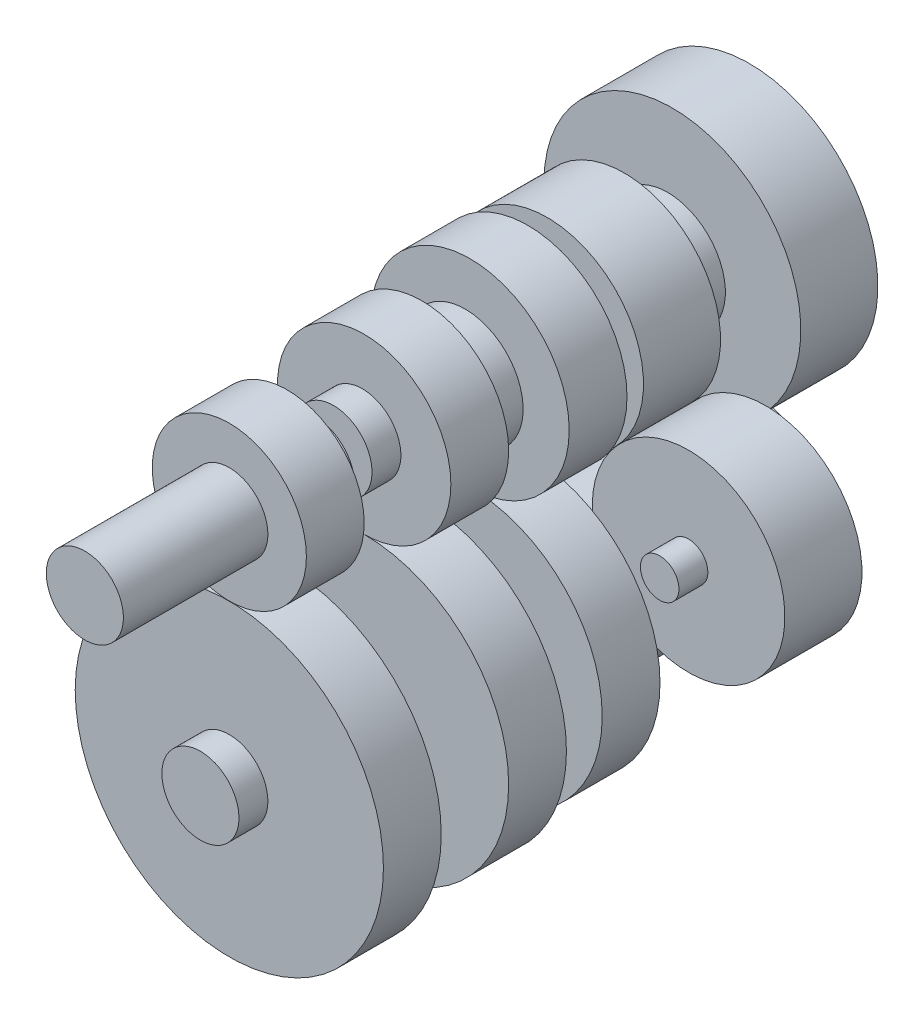
from build123d import *

# Parameters (mm, degrees)
SKETCH1_R             = 101.6
BOSS_EXTRUDE1_DEPTH   = 38.1
SKETCH1_R_2           = 50.8
BOSS_EXTRUDE1_2_DEPTH = 38.1
SKETCH2_R             = 25.4
BOSS_EXTRUDE2_DEPTH   = 50.8
SKETCH3_R             = 95.25
SKETCH3_R_2           = 25.4
SKETCH3_R_3           = 57.15
BOSS_EXTRUDE4_DEPTH   = 38.1
SKETCH4_R             = 25.4
BOSS_EXTRUDE5_DEPTH   = 3.175
SKETCH5_R             = 38.1
BOSS_EXTRUDE6_DEPTH   = 25.4
SKETCH6_R             = 25.4
BOSS_EXTRUDE7_DEPTH   = 3.175
SKETCH7_R             = 25.4
BOSS_EXTRUDE8_DEPTH   = 31.75
SKETCH8_R             = 87.085714286
SKETCH8_R_2           = 25.4
SKETCH8_R_3           = 65.314285714
BOSS_EXTRUDE9_DEPTH   = 38.1
SKETCH9_R             = 25.4
BOSS_EXTRUDE10_DEPTH  = 12.7
SKETCH10_R            = 63.5
SKETCH10_R_2          = 50.8
SKETCH10_R_3          = 25.4
BOSS_EXTRUDE11_DEPTH  = 50.8
SKETCH11_R            = 25.4
BOSS_EXTRUDE12_DEPTH  = 31.75
SKETCH12_R            = 25.4
BOSS_EXTRUDE13_DEPTH  = 3.175
SKETCH13_R            = 38.1
BOSS_EXTRUDE14_DEPTH  = 25.4
SKETCH14_R            = 25.4
BOSS_EXTRUDE15_DEPTH  = 3.175
SKETCH15_R            = 63.5
SKETCH15_R_2          = 50.8
SKETCH15_R_3          = 25.4
SKETCH15_R_4          = 84.666666667
BOSS_EXTRUDE16_DEPTH  = 50.8
SKETCH16_R            = 12.7
BOSS_EXTRUDE17_DEPTH  = 19.05
SKETCH17_R            = 12.7
BOSS_EXTRUDE18_DEPTH  = 19.05
SKETCH18_R            = 25.4
SKETCH18_R_2          = 12.7
BOSS_EXTRUDE19_DEPTH  = 19.05
SKETCH19_R            = 12.7
BOSS_EXTRUDE20_DEPTH  = 50.8
SKETCH20_R            = 25.4
BOSS_EXTRUDE21_DEPTH  = 19.05
SKETCH21_R            = 25.4
BOSS_EXTRUDE22_DEPTH  = 19.05
SKETCH22_R            = 25.4
BOSS_EXTRUDE23_DEPTH  = 19.05
SKETCH24_R            = 25.4
BOSS_EXTRUDE24_DEPTH  = 76.2


with BuildPart() as part:
    # Sketch1 → Boss-Extrude1 (new body)
    with BuildSketch(Plane.XY):
        Circle(SKETCH1_R)
    extrude(amount=-BOSS_EXTRUDE1_DEPTH)

    # Sketch2 → Boss-Extrude2 (add)
    with BuildSketch(Plane(origin=(0, 0, -38.1), x_dir=(-1, 0, 0), z_dir=(0, 0, -1))):
        Circle(SKETCH2_R)
    extrude(amount=BOSS_EXTRUDE2_DEPTH)

    # Sketch3 → Boss-Extrude4 (add)
    # profile 1 of 3: a face of its own
    with BuildSketch(Plane(origin=(0, 0, -88.9), x_dir=(-1, 0, 0), z_dir=(0, 0, -1))):
        with Locations(Location((0, 0, 0), (0, 0, 180))):
            Circle(SKETCH3_R)
        Circle(SKETCH3_R_2, mode=Mode.SUBTRACT)
    # profile 2 of 3: a face of its own
    with BuildSketch(Plane(origin=(0, 0, -88.9), x_dir=(-1, 0, 0), z_dir=(0, 0, -1))):
        Circle(SKETCH3_R_2)
    # profile 3 of 3: a face of its own
    with BuildSketch(Plane(origin=(0, 0, -88.9), x_dir=(-1, 0, 0), z_dir=(0, 0, -1))):
        with Locations(Location((0, 152.4, 0), (0, 0, 180))):
            Circle(SKETCH3_R_3)
    extrude(amount=BOSS_EXTRUDE4_DEPTH)


with BuildPart() as body_2:
    # Sketch1 → Boss-Extrude1 2 (new body)
    with BuildSketch(Plane.XY):
        with Locations((0, 152.4)):
            Circle(SKETCH1_R_2)
    extrude(amount=-BOSS_EXTRUDE1_2_DEPTH)



with BuildPart() as boss_extrude4_piece_1:
    # of the separate pieces the step leaves, piece 1, a body of its own (boss_extrude4_pieces)
    add(part.part.solids().sort_by_distance((95.25, 0, -88.9))[0])

    # Sketch7 → Boss-Extrude8 (add)
    with BuildSketch(Plane(origin=(0, 0, -127), x_dir=(-1, 0, 0), z_dir=(0, 0, -1))):
        Circle(SKETCH7_R)
    extrude(amount=BOSS_EXTRUDE8_DEPTH)



with BuildPart() as boss_extrude4_piece_2:
    # of the separate pieces the step leaves, piece 2, a body of its own (boss_extrude4_pieces)
    add(part.part.solids().sort_by_distance((57.15, 152.4, -88.9))[0])

    # Sketch4 → Boss-Extrude5 (add)
    with BuildSketch(Plane(origin=(0, 0, -127), x_dir=(-1, 0, 0), z_dir=(0, 0, -1))):
        with Locations((0, 152.4)):
            Circle(SKETCH4_R)
    extrude(amount=BOSS_EXTRUDE5_DEPTH)

    # Sketch5 → Boss-Extrude6 (add)
    with BuildSketch(Plane(origin=(0, 0, -130.175), x_dir=(-1, 0, 0), z_dir=(0, 0, -1))):
        with Locations((0, 152.4)):
            Circle(SKETCH5_R)
    extrude(amount=BOSS_EXTRUDE6_DEPTH)

    # Sketch6 → Boss-Extrude7 (add)
    with BuildSketch(Plane(origin=(0, 0, -155.575), x_dir=(-1, 0, 0), z_dir=(0, 0, -1))):
        with Locations((0, 152.4)):
            Circle(SKETCH6_R)
    extrude(amount=BOSS_EXTRUDE7_DEPTH)


with BuildPart() as boss_extrude4_piece_1_1:
    add(boss_extrude4_piece_1.part)

    add(boss_extrude4_piece_2.part)  # Boss-Extrude9 merges Boss-Extrude4 piece 2
    # Sketch8 → Boss-Extrude9 (add)
    # profile 1 of 3: a face of its own
    with BuildSketch(Plane(origin=(0, 0, -158.75), x_dir=(-1, 0, 0), z_dir=(0, 0, -1))):
        with Locations(Location((0, 0, 0), (0, 0, 180))):
            Circle(SKETCH8_R)
        Circle(SKETCH8_R_2, mode=Mode.SUBTRACT)
    # profile 2 of 3: a face of its own
    with BuildSketch(Plane(origin=(0, 0, -158.75), x_dir=(-1, 0, 0), z_dir=(0, 0, -1))):
        Circle(SKETCH8_R_2)
    # profile 3 of 3: a face of its own
    with BuildSketch(Plane(origin=(0, 0, -158.75), x_dir=(-1, 0, 0), z_dir=(0, 0, -1))):
        with Locations(Location((0, 152.4, 0), (0, 0, 180))):
            Circle(SKETCH8_R_3)
    extrude(amount=BOSS_EXTRUDE9_DEPTH)

    # Sketch9 → Boss-Extrude10 (add)
    with BuildSketch(Plane(origin=(0, 0, -196.85), x_dir=(-1, 0, 0), z_dir=(0, 0, -1))):
        Circle(SKETCH9_R)
        with Locations((0, 152.4)):
            Circle(SKETCH9_R)
    extrude(amount=BOSS_EXTRUDE10_DEPTH)

    # Sketch10 → Boss-Extrude11 (add)
    # profile 1 of 4: a face of its own
    with BuildSketch(Plane(origin=(0, 0, -209.55), x_dir=(-1, 0, 0), z_dir=(0, 0, -1))):
        with Locations((-93.215978956, 66.145833333)):
            Circle(SKETCH10_R)
    # profile 2 of 4: a face of its own
    with BuildSketch(Plane(origin=(0, 0, -209.55), x_dir=(-1, 0, 0), z_dir=(0, 0, -1))):
        Circle(SKETCH10_R_2)
        Circle(SKETCH10_R_3, mode=Mode.SUBTRACT)
    # profile 3 of 4: a face of its own
    with BuildSketch(Plane(origin=(0, 0, -209.55), x_dir=(-1, 0, 0), z_dir=(0, 0, -1))):
        Circle(SKETCH10_R_3)
    # profile 4 of 4: a face of its own
    with BuildSketch(Plane(origin=(0, 0, -209.55), x_dir=(-1, 0, 0), z_dir=(0, 0, -1))):
        with Locations((0, 152.4)):
            Circle(SKETCH10_R)
    extrude(amount=BOSS_EXTRUDE11_DEPTH)

    # Sketch11 → Boss-Extrude12 (add)
    with BuildSketch(Plane(origin=(0, 0, -260.35), x_dir=(-1, 0, 0), z_dir=(0, 0, -1))):
        Circle(SKETCH11_R)
    extrude(amount=BOSS_EXTRUDE12_DEPTH)

    # Sketch12 → Boss-Extrude13 (add)
    with BuildSketch(Plane(origin=(0, 0, -260.35), x_dir=(-1, 0, 0), z_dir=(0, 0, -1))):
        with Locations((0, 152.4)):
            Circle(SKETCH12_R)
    extrude(amount=BOSS_EXTRUDE13_DEPTH)

    # Sketch13 → Boss-Extrude14 (add)
    with BuildSketch(Plane(origin=(0, 0, -263.525), x_dir=(-1, 0, 0), z_dir=(0, 0, -1))):
        with Locations((0, 152.4)):
            Circle(SKETCH13_R)
    extrude(amount=BOSS_EXTRUDE14_DEPTH)

    # Sketch14 → Boss-Extrude15 (add)
    with BuildSketch(Plane(origin=(0, 0, -288.925), x_dir=(-1, 0, 0), z_dir=(0, 0, -1))):
        with Locations((0, 152.4)):
            Circle(SKETCH14_R)
    extrude(amount=BOSS_EXTRUDE15_DEPTH)

    # Sketch15 → Boss-Extrude16 (add)
    # profile 1 of 4: a face of its own
    with BuildSketch(Plane(origin=(0, 0, -292.1), x_dir=(-1, 0, 0), z_dir=(0, 0, -1))):
        with Locations((104.172967447, 47.037037037)):
            Circle(SKETCH15_R)
    # profile 2 of 4: a face of its own
    with BuildSketch(Plane(origin=(0, 0, -292.1), x_dir=(-1, 0, 0), z_dir=(0, 0, -1))):
        Circle(SKETCH15_R_2)
        Circle(SKETCH15_R_3, mode=Mode.SUBTRACT)
    # profile 3 of 4: a face of its own
    with BuildSketch(Plane(origin=(0, 0, -292.1), x_dir=(-1, 0, 0), z_dir=(0, 0, -1))):
        Circle(SKETCH15_R_3)
    # profile 4 of 4: a face of its own
    with BuildSketch(Plane(origin=(0, 0, -292.1), x_dir=(-1, 0, 0), z_dir=(0, 0, -1))):
        with Locations((0, 152.4)):
            Circle(SKETCH15_R_4)
    extrude(amount=BOSS_EXTRUDE16_DEPTH)

    # Sketch16 → Boss-Extrude17 (add)
    with BuildSketch(Plane.XY.offset(-209.55)):
        with Locations(Location((93.215978956, 66.145833333, 0), (0, 0, 180))):
            Circle(SKETCH16_R)
    extrude(amount=BOSS_EXTRUDE17_DEPTH)

    # Sketch17 → Boss-Extrude18 (add)
    with BuildSketch(Plane(origin=(0, 0, -260.35), x_dir=(-1, 0, 0), z_dir=(0, 0, -1))):
        with Locations((-93.215978956, 66.145833333)):
            Circle(SKETCH17_R)
    extrude(amount=BOSS_EXTRUDE18_DEPTH)

    # Sketch18 → Boss-Extrude19 (add)
    with BuildSketch(Plane(origin=(0, 0, -342.9), x_dir=(-1, 0, 0), z_dir=(0, 0, -1))):
        with Locations((0, 152.4)):
            Circle(SKETCH18_R)
        with Locations(Location((104.172967447, 47.037037037, 0), (0, 0, 180))):
            Circle(SKETCH18_R_2)
        Circle(SKETCH18_R)
    extrude(amount=BOSS_EXTRUDE19_DEPTH)

    # Sketch19 → Boss-Extrude20 (add)
    with BuildSketch(Plane.XY.offset(-292.1)):
        with Locations((-104.172967447, 47.037037037)):
            Circle(SKETCH19_R)
    extrude(amount=BOSS_EXTRUDE20_DEPTH)


with BuildPart() as body_2_1:
    add(body_2.part)

    add(boss_extrude4_piece_1_1.part)  # Boss-Extrude21 merges Boss-Extrude4 piece 1
    # Sketch20 → Boss-Extrude21 (add)
    with BuildSketch(Plane.XY):
        with Locations(Location((0, 0, 0), (0, 0, 180))):
            Circle(SKETCH20_R)
        with Locations(Location((0, 152.4, 0), (0, 0, 180))):
            Circle(SKETCH20_R)
    extrude(amount=BOSS_EXTRUDE21_DEPTH)

    # Sketch21 → Boss-Extrude22 (add)
    with BuildSketch(Plane.XY.offset(-88.9)):
        with Locations(Location((-1.187158257, 152.4, 0), (0, 0, 180))):
            Circle(SKETCH21_R)
    extrude(amount=BOSS_EXTRUDE22_DEPTH)

    # Sketch22 → Boss-Extrude23 (add)
    with BuildSketch(Plane(origin=(0, 0, -38.1), x_dir=(-1, 0, 0), z_dir=(0, 0, -1))):
        with Locations((0, 152.4)):
            Circle(SKETCH22_R)
    extrude(amount=BOSS_EXTRUDE23_DEPTH)

    # Sketch24 → Boss-Extrude24 (add)
    with BuildSketch(Plane.XY.offset(19.05)):
        with Locations(Location((0, 152.4, 0), (0, 0, 180))):
            Circle(SKETCH24_R)
    extrude(amount=BOSS_EXTRUDE24_DEPTH)


solid = body_2_1.part
